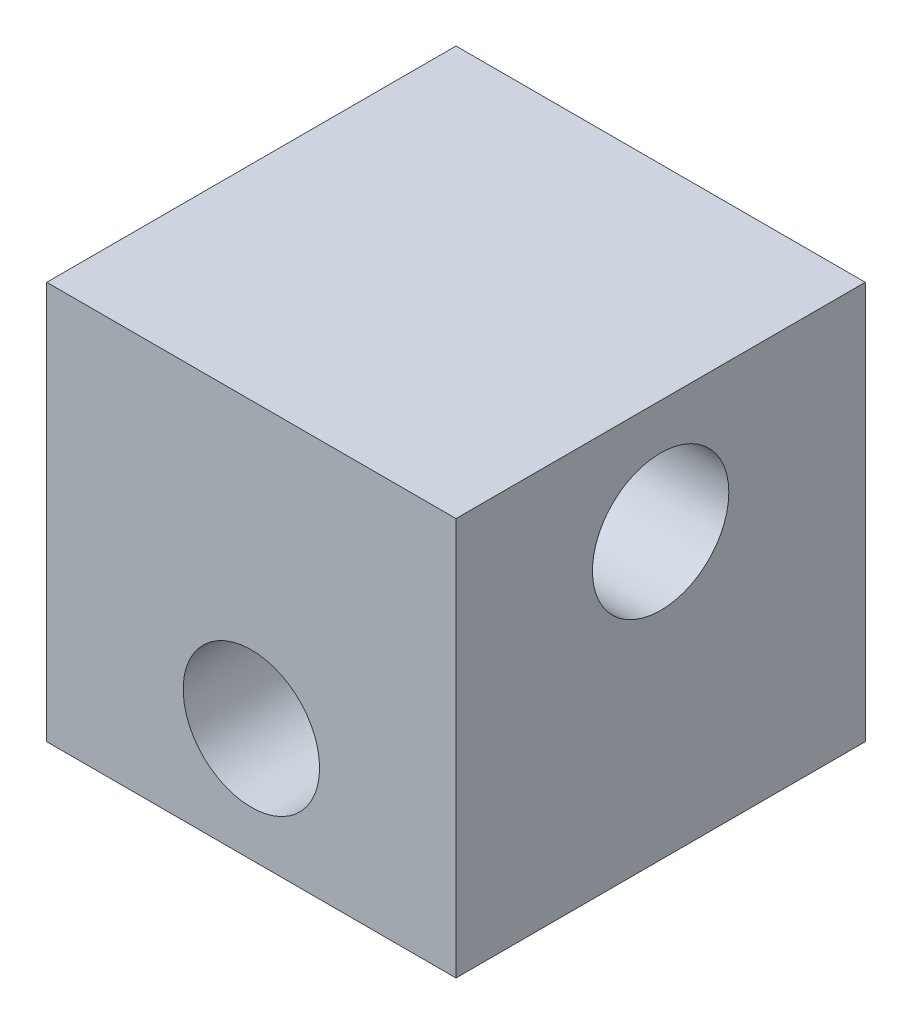
from build123d import *

# Parameters (mm, degrees)
SKETCH1_W           = 36
SKETCH1_H           = 36
BOSS_EXTRUDE1_DEPTH = 35
SKETCH2_R           = 6
CUT_EXTRUDE1_DEPTH  = 54.338541412
SKETCH3_R           = 6
CUT_EXTRUDE2_DEPTH  = 54.338541412


with BuildPart() as part:
    # Sketch1 → Boss-Extrude1 (new body)
    with BuildSketch(Plane(origin=(0, 0, 0), x_dir=(1, 0, 0), z_dir=(0, 1, 0))):
        Rectangle(SKETCH1_W, SKETCH1_H)
    extrude(amount=BOSS_EXTRUDE1_DEPTH)

    # Sketch2 → Cut-Extrude1 (cut, through all)
    with BuildSketch(Plane.XY.offset(18)):
        with Locations((0, 10)):
            Circle(SKETCH2_R)
    extrude(amount=-CUT_EXTRUDE1_DEPTH, mode=Mode.SUBTRACT)

    # Sketch3 → Cut-Extrude2 (cut, through all)
    with BuildSketch(Plane(origin=(18, 0, 0), x_dir=(0, 0, -1), z_dir=(1, 0, 0))):
        with Locations((0, 25)):
            Circle(SKETCH3_R)
    extrude(amount=-CUT_EXTRUDE2_DEPTH, mode=Mode.SUBTRACT)


solid = part.part
